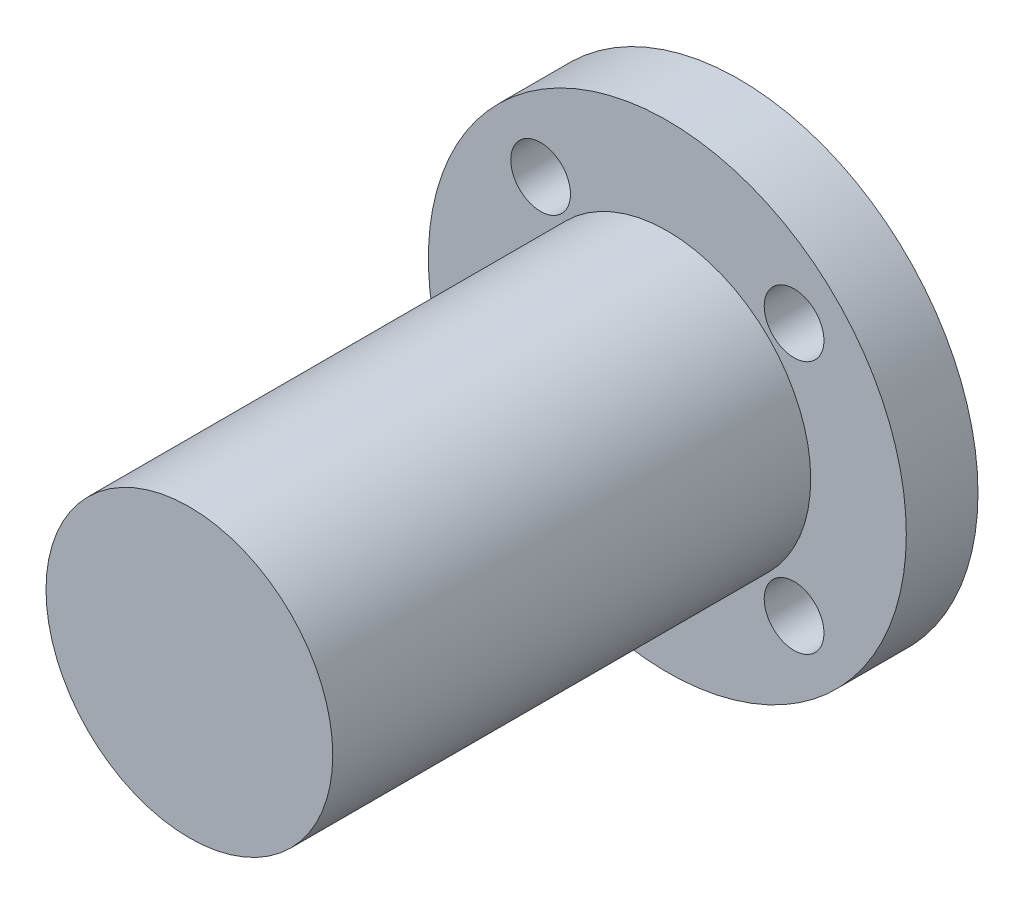
from build123d import *

# Parameters (mm, degrees)
SKETCH_1_R          = 10
EXTRUDE_1_DEPTH     = 3
SKETCH_2_R          = 6
EXTRUDE_2_DEPTH     = 20
CUT_EXTRUDE_1_REACH = 29
SKETCH_4_R          = 1.25


with BuildPart() as part:
    # 草图1 → 凸台-拉伸1 (new body)
    with BuildSketch(Plane.XY):
        Circle(SKETCH_1_R)
    extrude(amount=EXTRUDE_1_DEPTH)

    # 草图2 → 凸台-拉伸2 (add)
    with BuildSketch(Plane.XY.offset(3)):
        Circle(SKETCH_2_R)
    extrude(amount=EXTRUDE_2_DEPTH)

    # 草图4 → 切除-拉伸1 (cut, up to next)
    with BuildSketch(Plane(origin=(0, 0, 0), x_dir=(-1, 0, 0), z_dir=(0, 0, -1)), mode=Mode.PRIVATE) as cut_extrude_1_sk1:
        with Locations((-5.303300859, 5.303300859)):
            Circle(SKETCH_4_R)
    cut_extrude_1_tool1 = extrude(cut_extrude_1_sk1.sketch, amount=-CUT_EXTRUDE_1_REACH, mode=Mode.PRIVATE) & part.part
    # 草图4 → 切除-拉伸1 (cut, up to next)
    with BuildSketch(Plane(origin=(0, 0, 0), x_dir=(-1, 0, 0), z_dir=(0, 0, -1)), mode=Mode.PRIVATE) as cut_extrude_1_sk2:
        with Locations((5.303300859, 5.303300859)):
            Circle(SKETCH_4_R)
    cut_extrude_1_tool2 = extrude(cut_extrude_1_sk2.sketch, amount=-CUT_EXTRUDE_1_REACH, mode=Mode.PRIVATE) & part.part
    # 草图4 → 切除-拉伸1 (cut, up to next)
    with BuildSketch(Plane(origin=(0, 0, 0), x_dir=(-1, 0, 0), z_dir=(0, 0, -1)), mode=Mode.PRIVATE) as cut_extrude_1_sk3:
        with Locations((5.303300859, -5.303300859)):
            Circle(SKETCH_4_R)
    cut_extrude_1_tool3 = extrude(cut_extrude_1_sk3.sketch, amount=-CUT_EXTRUDE_1_REACH, mode=Mode.PRIVATE) & part.part
    # 草图4 → 切除-拉伸1 (cut, up to next)
    with BuildSketch(Plane(origin=(0, 0, 0), x_dir=(-1, 0, 0), z_dir=(0, 0, -1)), mode=Mode.PRIVATE) as cut_extrude_1_sk4:
        with Locations((-5.303300859, -5.303300859)):
            Circle(SKETCH_4_R)
    cut_extrude_1_tool4 = extrude(cut_extrude_1_sk4.sketch, amount=-CUT_EXTRUDE_1_REACH, mode=Mode.PRIVATE) & part.part
    add(cut_extrude_1_tool1.solids().sort_by_distance((5.303301, 5.303301, 0))[0], mode=Mode.SUBTRACT)
    add(cut_extrude_1_tool2.solids().sort_by_distance((-5.303301, 5.303301, 0))[0], mode=Mode.SUBTRACT)
    add(cut_extrude_1_tool3.solids().sort_by_distance((-5.303301, -5.303301, 0))[0], mode=Mode.SUBTRACT)
    add(cut_extrude_1_tool4.solids().sort_by_distance((5.303301, -5.303301, 0))[0], mode=Mode.SUBTRACT)


solid = part.part
